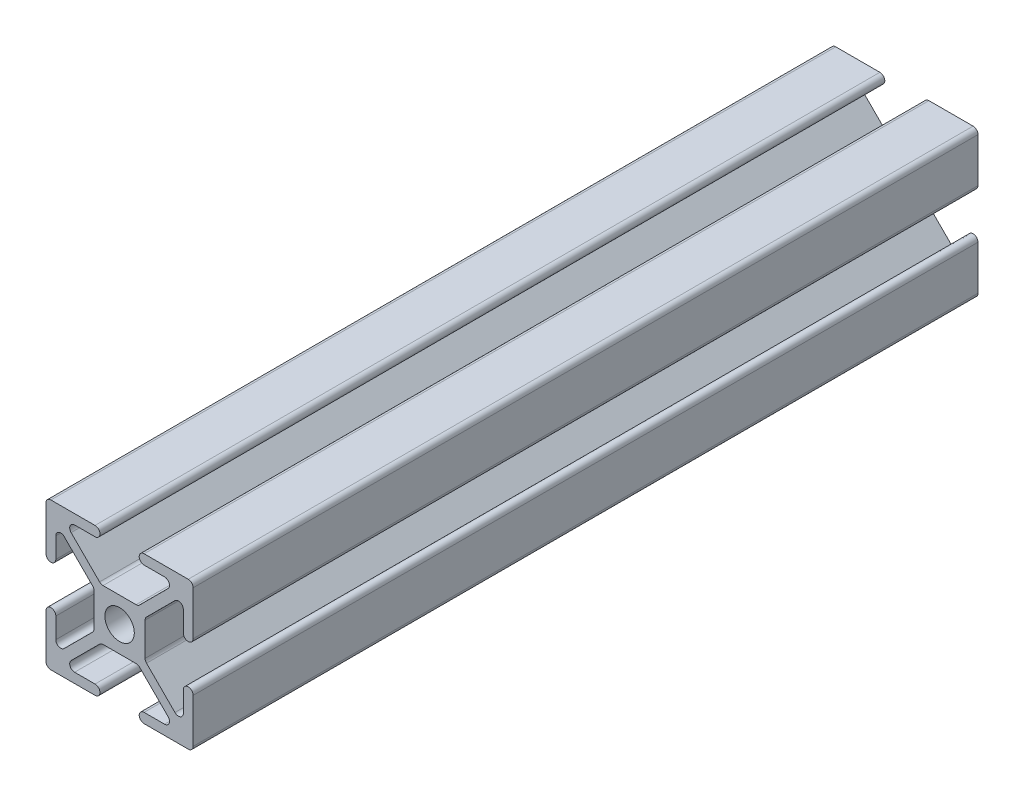
from build123d import *

# Parameters (mm, degrees)
SALIENTE_EXTRUIR1_DEPTH = 190
CROQUIS2_R              = 3
CORTAR_EXTRUIR1_DEPTH   = 192.180542943
CORTAR_EXTRUIR3_DEPTH   = 192.180542943
CROQUIS4_W              = 33.127581221
CROQUIS4_H              = 30
CORTAR_EXTRUIR4_DEPTH   = 38


with BuildPart() as part:
    # Croquis1 → Saliente-Extruir1 (new body)
    with BuildSketch(Plane.XY):
        with BuildLine():
            Line((-14, 15), (14, 15))
            ThreePointArc((14, 15), (14.707106781, 14.707106781), (15, 14))
            Line((15, 14), (15, -14))
            ThreePointArc((15, -14), (14.707106781, -14.707106781), (14, -15))
            Line((14, -15), (-14, -15))
            ThreePointArc((-14, -15), (-14.707106781, -14.707106781), (-15, -14))
            Line((-15, -14), (-15, 14))
            ThreePointArc((-15, 14), (-14.707106781, 14.707106781), (-14, 15))
        make_face()
    extrude(amount=-SALIENTE_EXTRUIR1_DEPTH)

    # Croquis2 → Cortar-Extruir1 (cut, through all)
    with BuildSketch(Plane.XY):
        Circle(CROQUIS2_R)
    extrude(amount=-CORTAR_EXTRUIR1_DEPTH, mode=Mode.SUBTRACT)

    # Croquis3 → Cortar-Extruir3 (cut, through all)
    with BuildSketch(Plane.XY):
        with BuildLine():
            Line((-5.492893219, 4.078679656), (-11.292893219, 9.878679656))
            ThreePointArc((-11.292893219, 9.878679656), (-12.382683432, 10.095452408), (-13, 9.171572875))
            Line((-13, 9.171572875), (-13, 5))
            ThreePointArc((-13, 5), (-14, 4), (-15, 5))
            Line((-15, 5), (-15, -5))
            ThreePointArc((-15, -5), (-14, -4), (-13, -5))
            Line((-13, -5), (-13, -9.171572875))
            ThreePointArc((-13, -9.171572875), (-12.382683432, -10.095452408), (-11.292893219, -9.878679656))
            Line((-11.292893219, -9.878679656), (-5.492893219, -4.078679656))
            ThreePointArc((-5.492893219, -4.078679656), (-5.276120467, -3.754256308), (-5.2, -3.371572875))
            Line((-5.2, -3.371572875), (-5.2, 3.371572875))
            ThreePointArc((-5.2, 3.371572875), (-5.276120467, 3.754256308), (-5.492893219, 4.078679656))
        make_face()
        with BuildLine():
            ThreePointArc((-9.171572875, 13), (-10.095452408, 12.382683432), (-9.878679656, 11.292893219))
            Line((-9.878679656, 11.292893219), (-4.078679656, 5.492893219))
            ThreePointArc((-4.078679656, 5.492893219), (-3.754256308, 5.276120467), (-3.371572875, 5.2))
            Line((-3.371572875, 5.2), (3.371572875, 5.2))
            ThreePointArc((3.371572875, 5.2), (3.754256308, 5.276120467), (4.078679656, 5.492893219))
            Line((4.078679656, 5.492893219), (9.878679656, 11.292893219))
            ThreePointArc((9.878679656, 11.292893219), (10.095452408, 12.382683432), (9.171572875, 13))
            Line((9.171572875, 13), (5, 13))
            ThreePointArc((5, 13), (4, 14), (5, 15))
            Line((5, 15), (-5, 15))
            ThreePointArc((-5, 15), (-4.292893219, 14.707106781), (-4, 14))
            ThreePointArc((-4, 14), (-4.292893219, 13.292893219), (-5, 13))
            Line((-5, 13), (-9.171572875, 13))
        make_face()
        with BuildLine():
            Line((9.878679656, -11.292893219), (4.078679656, -5.492893219))
            ThreePointArc((4.078679656, -5.492893219), (3.754256308, -5.276120467), (3.371572875, -5.2))
            Line((3.371572875, -5.2), (-3.371572875, -5.2))
            ThreePointArc((-3.371572875, -5.2), (-3.754256308, -5.276120467), (-4.078679656, -5.492893219))
            Line((-4.078679656, -5.492893219), (-9.878679656, -11.292893219))
            ThreePointArc((-9.878679656, -11.292893219), (-10.095452408, -12.382683432), (-9.171572875, -13))
            Line((-9.171572875, -13), (-5, -13))
            ThreePointArc((-5, -13), (-4.292893219, -13.292893219), (-4, -14))
            ThreePointArc((-4, -14), (-4.292893219, -14.707106781), (-5, -15))
            Line((-5, -15), (5, -15))
            ThreePointArc((5, -15), (4, -14), (5, -13))
            Line((5, -13), (9.171572875, -13))
            ThreePointArc((9.171572875, -13), (10.095452408, -12.382683432), (9.878679656, -11.292893219))
        make_face()
        with BuildLine():
            ThreePointArc((13, 9.171572875), (12.382683432, 10.095452408), (11.292893219, 9.878679656))
            Line((11.292893219, 9.878679656), (5.492893219, 4.078679656))
            ThreePointArc((5.492893219, 4.078679656), (5.276120467, 3.754256308), (5.2, 3.371572875))
            Line((5.2, 3.371572875), (5.2, -3.371572875))
            ThreePointArc((5.2, -3.371572875), (5.276120467, -3.754256308), (5.492893219, -4.078679656))
            Line((5.492893219, -4.078679656), (11.292893219, -9.878679656))
            ThreePointArc((11.292893219, -9.878679656), (12.382683432, -10.095452408), (13, -9.171572875))
            Line((13, -9.171572875), (13, -5))
            ThreePointArc((13, -5), (14, -4), (15, -5))
            Line((15, -5), (15, 5))
            ThreePointArc((15, 5), (14, 4), (13, 5))
            Line((13, 5), (13, 9.171572875))
        make_face()
    extrude(amount=-CORTAR_EXTRUIR3_DEPTH, mode=Mode.SUBTRACT)

    # Croquis4 → Cortar-Extruir4 (cut)
    with BuildSketch(Plane(origin=(0, 15, 0), x_dir=(1, 0, 0), z_dir=(0, 1, 0))):
        with Locations((-1.56379061, 15)):
            Rectangle(CROQUIS4_W, CROQUIS4_H)
    extrude(amount=-CORTAR_EXTRUIR4_DEPTH, mode=Mode.SUBTRACT)


solid = part.part
